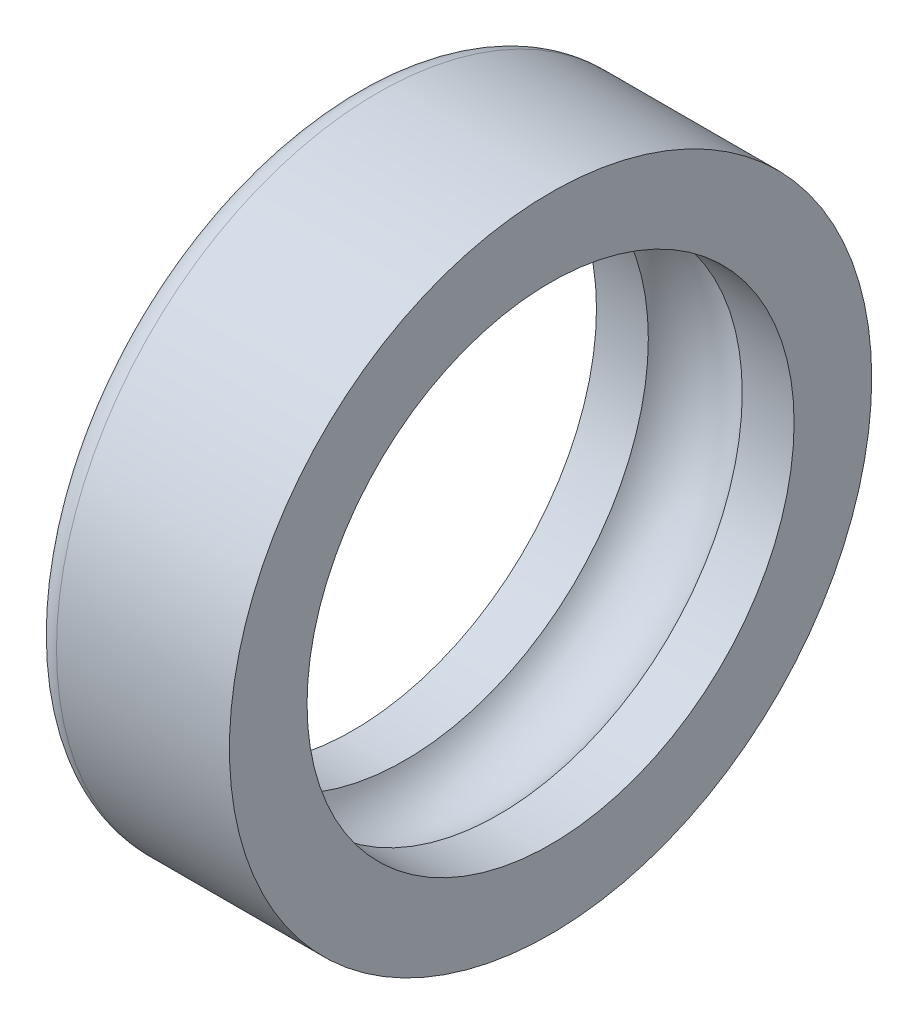
from build123d import *

# Parameters (mm, degrees)
FILLET1_R = 1


with BuildPart() as part:
    # Sketch1 → Revolve1 (revolve)
    with BuildSketch(Plane.XY, mode=Mode.PRIVATE) as revolve1_sk:
        with BuildLine():
            Line((0, 4.25), (4, 4.25))
            Line((4, 4.25), (4, 1.108))
            Line((4, 1.108), (1.900614637, 1.108))
            ThreePointArc((1.900614637, 1.108), (0, 2.2), (-1.900614637, 1.108))
            Line((-1.900614637, 1.108), (-4, 1.108))
            Line((-4, 1.108), (-4, 4.25))
            Line((-4, 4.25), (0, 4.25))
        make_face()
    revolve(revolve1_sk.sketch.rotate(Axis((4, -8.75, 0), (-1, 0, 0)), 90), axis=Axis((4, -8.75, 0), (-1, 0, 0)))

    # Fillet1
    fillet1_edges = [part.edges().sort_by_distance(p)[0] for p in [
        (-4, -8.75, 13),
    ]]
    fillet(fillet1_edges, radius=FILLET1_R)


solid = part.part
